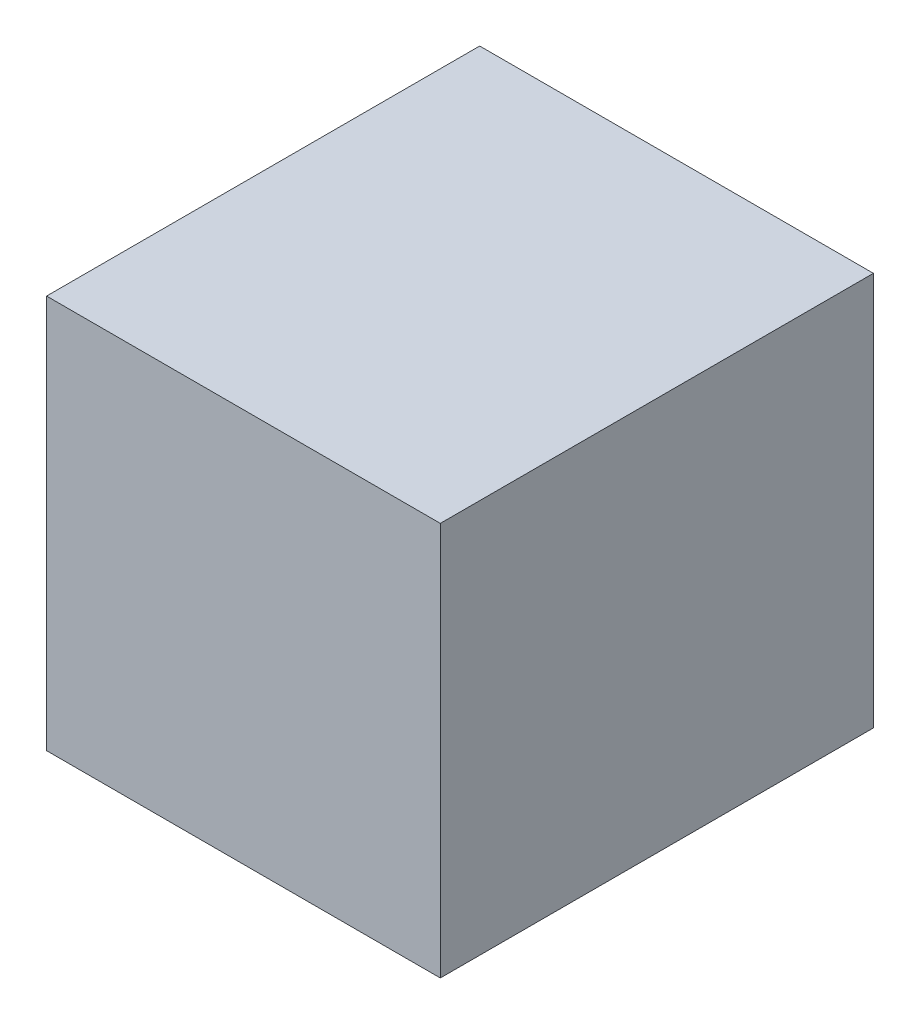
from build123d import *

# Parameters (mm, degrees)
PACK_PANO_PSU_24V_1_START = -138
SKETCH1_W                 = 100
SKETCH1_H                 = 100
PACK_PANO_PSU_24V_1_DEPTH = 110


with BuildPart() as part:
    # Sketch1 → PACK_pano_psu_24V_1 (new body)
    with BuildSketch(Plane.XY.offset(PACK_PANO_PSU_24V_1_START)):
        with Locations((250, 230)):
            Rectangle(SKETCH1_W, SKETCH1_H)
    extrude(amount=-PACK_PANO_PSU_24V_1_DEPTH)


solid = part.part
